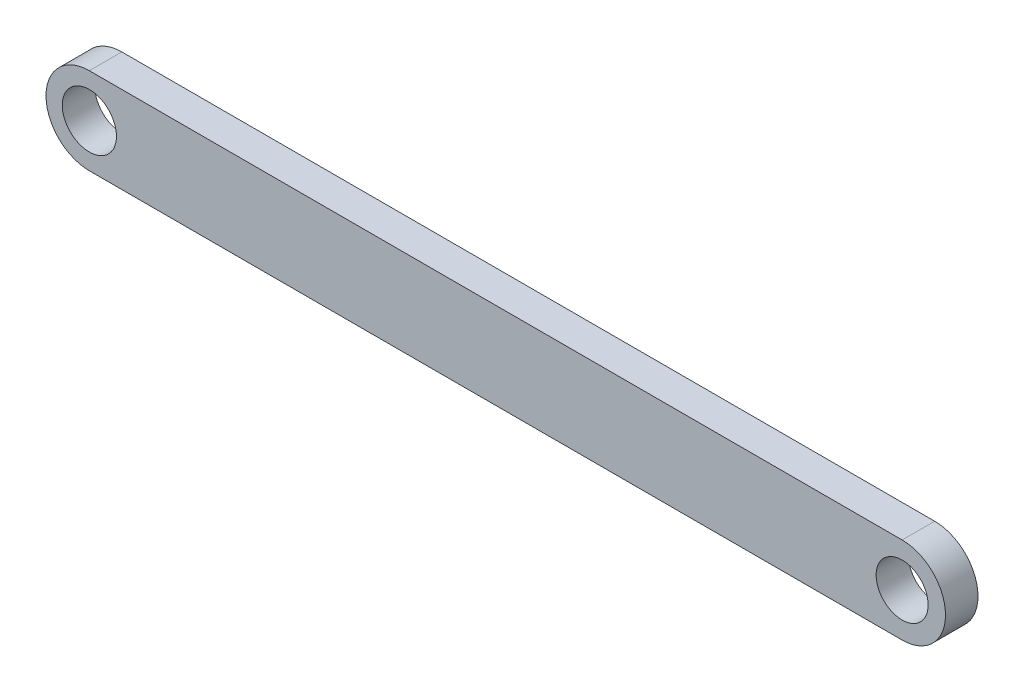
from build123d import *

# Parameters (mm, degrees)
SKETCH1_R           = 2.5
SKETCH1_R_2         = 2.4
BOSS_EXTRUDE1_DEPTH = 3


with BuildPart() as part:
    # Sketch1 → Boss-Extrude1 (new body)
    with BuildSketch(Plane(origin=(0, 34.703080777, 0), x_dir=(1, 0, 0), z_dir=(0, 0, 1))):
        with BuildLine():
            Line((-30.372366657, 17.432635687), (44.627633343, 17.432635687))
            ThreePointArc((44.627633343, 17.432635687), (48.627633343, 13.432635687), (44.627633343, 9.432635687))
            Line((44.627633343, 9.432635687), (-30.372366657, 9.432635687))
            ThreePointArc((-30.372366657, 9.432635687), (-34.372366657, 13.432635687), (-30.372366657, 17.432635687))
        make_face()
        with Locations((-30.372366657, 13.432635687)):
            Circle(SKETCH1_R, mode=Mode.SUBTRACT)
        with Locations((44.627633343, 13.432635687)):
            Circle(SKETCH1_R_2, mode=Mode.SUBTRACT)
    extrude(amount=BOSS_EXTRUDE1_DEPTH)


solid = part.part
